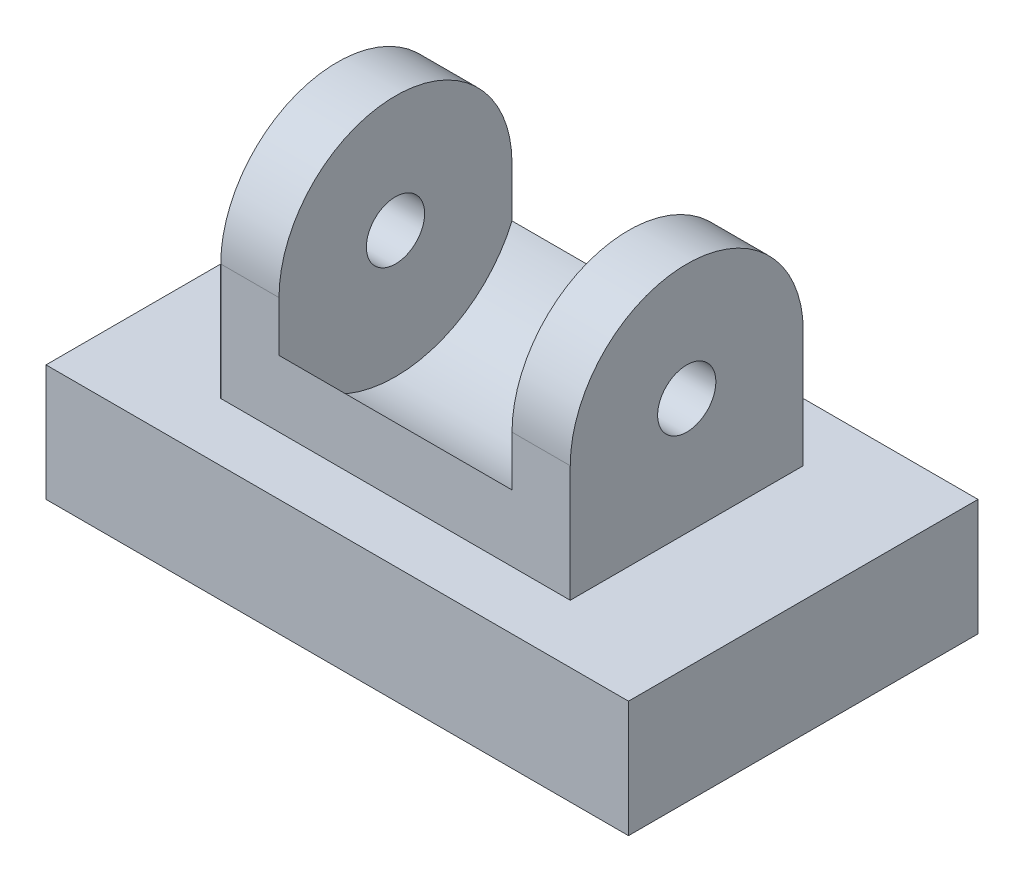
from build123d import *

# Parameters (mm, degrees)
ESQUISSE1_W                  = 50
ESQUISSE1_H                  = 30
BOSS_EXTRU_1_DEPTH           = 10
BOSS_EXTRU_2_DEPTH           = 15
BOSS_EXTRU_2_DEPTH_BACK      = 15
ESQUISSE2_R                  = 2.5
ENL_V_MAT_EXTRU_1_DEPTH      = 10
ENL_V_MAT_EXTRU_1_DEPTH_BACK = 10
ESQUISSE3_R                  = 10.88408721
ESQUISSE3_R_2                = 2.5


with BuildPart() as part:
    # Esquisse1 → Boss.-Extru.1 (new body)
    with BuildSketch(Plane(origin=(0, 0, 0), x_dir=(1, 0, 0), z_dir=(0, 1, 0))):
        Rectangle(ESQUISSE1_W, ESQUISSE1_H)
    extrude(amount=BOSS_EXTRU_1_DEPTH)

    # Esquisse2 → Boss.-Extru.2 (add, two sides: drawn at the far end of the back side and taken through both)
    with BuildSketch(Plane(origin=(0, 0, 0), x_dir=(0, 0, -1), z_dir=(1, 0, 0)).offset(-BOSS_EXTRU_2_DEPTH_BACK)):
        with BuildLine():
            Line((-10, 20), (-10, 10))
            Line((-10, 10), (10, 10))
            Line((10, 10), (10, 20))
            ThreePointArc((10, 20), (0, 30), (-10, 20))
        make_face()
        with Locations((0, 20)):
            Circle(ESQUISSE2_R, mode=Mode.SUBTRACT)
    extrude(amount=BOSS_EXTRU_2_DEPTH + BOSS_EXTRU_2_DEPTH_BACK)

    # Esquisse3 → Enlèv. mat.-Extru.1 (cut, two sides: drawn at the far end of the back side and taken through both)
    with BuildSketch(Plane(origin=(0, 0, 0), x_dir=(0, 0, -1), z_dir=(1, 0, 0)).offset(-ENL_V_MAT_EXTRU_1_DEPTH_BACK)):
        with Locations((0, 20)):
            Circle(ESQUISSE3_R)
        with Locations((0, 20)):
            Circle(ESQUISSE3_R_2, mode=Mode.SUBTRACT)
    extrude(amount=ENL_V_MAT_EXTRU_1_DEPTH + ENL_V_MAT_EXTRU_1_DEPTH_BACK, mode=Mode.SUBTRACT)


solid = part.part
